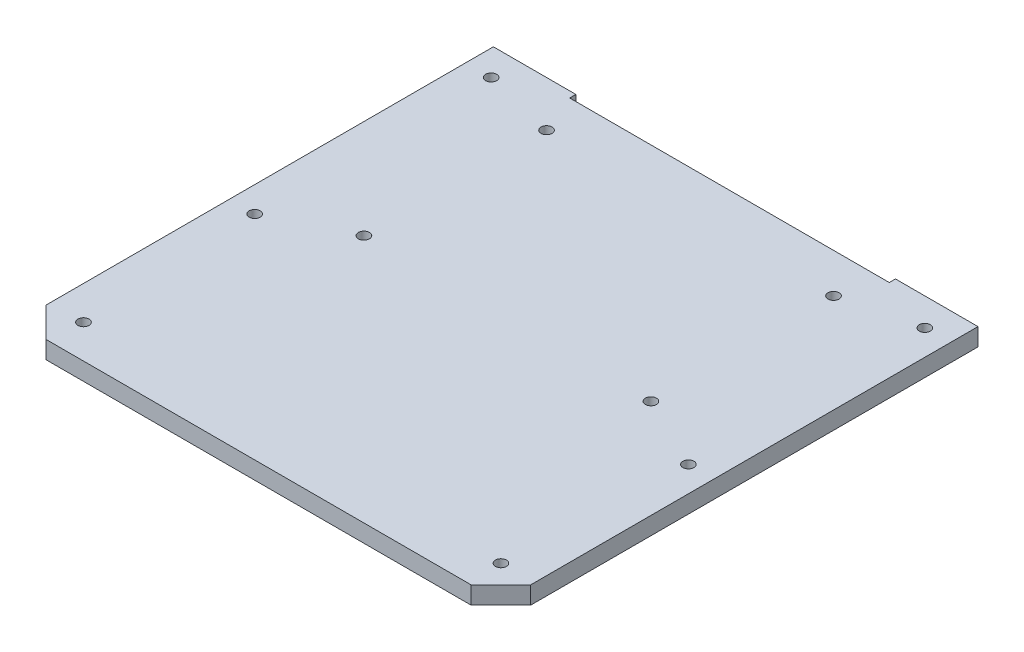
from build123d import *

# Parameters (mm, degrees)
LID_PLATE_DEPTH        = 2.4
DRIP_SKIRT_DEPTH       = 3.01
SKETCH3_W              = 25.3
SKETCH3_H              = 1.9
FRONT_SKIRT_L_DEPTH    = 5.4
SKETCH4_W              = 25.3
SKETCH4_H              = 1.9
FRONT_SKIRT_R_DEPTH    = 5.4
SKETCH5_W              = 63
SKETCH5_H              = 34
GNSS_THIN_WINDOW_DEPTH = 1.7
SKETCH6_R              = 1.7
SCREW_HOLES_DEPTH      = 4.4


with BuildPart() as part:
    # Sketch1 → Lid Plate (new body)
    with BuildSketch(Plane(origin=(0, 10, 0), x_dir=(1, 0, 0), z_dir=(0, 1, 0))):
        Polygon((-65.187005769, -156.3), (65.187005769, -156.3), (74.3, -147.187005769), (74.3, -11.9), (-74.3, -11.9), (-74.3, -147.187005769), align=None)
    extrude(amount=LID_PLATE_DEPTH)

    # Sketch2 → Drip Skirt (add)
    with BuildSketch(Plane(origin=(0, 7, 0), x_dir=(1, 0, 0), z_dir=(0, 1, 0))):
        Polygon((74.3, -11.9), (74.3, -147.187005769), (65.187005769, -156.3), (-65.187005769, -156.3), (-74.3, -147.187005769), (-74.3, -11.9), (-72.7, -11.9), (-72.7, -146.524264069), (-64.524264069, -154.7), (64.524264069, -154.7), (72.7, -146.524264069), (72.7, -11.9), align=None)
    extrude(amount=DRIP_SKIRT_DEPTH)

    # Sketch3 → Front Skirt L (add)
    with BuildSketch(Plane(origin=(0, 7, 0), x_dir=(1, 0, 0), z_dir=(0, 1, 0))):
        with Locations((-61.65, -10.95)):
            Rectangle(SKETCH3_W, SKETCH3_H)
    extrude(amount=FRONT_SKIRT_L_DEPTH)

    # Sketch4 → Front Skirt R (add)
    with BuildSketch(Plane(origin=(0, 7, 0), x_dir=(1, 0, 0), z_dir=(0, 1, 0))):
        with Locations((61.65, -10.95)):
            Rectangle(SKETCH4_W, SKETCH4_H)
    extrude(amount=FRONT_SKIRT_R_DEPTH)

    # Sketch5 → GNSS Thin Window (cut)
    with BuildSketch(Plane(origin=(0, 9.5, 0), x_dir=(1, 0, 0), z_dir=(0, 1, 0))):
        with Locations((-8.5, -123)):
            Rectangle(SKETCH5_W, SKETCH5_H)
    extrude(amount=GNSS_THIN_WINDOW_DEPTH, mode=Mode.SUBTRACT)

    # Sketch6 → Screw Holes (cut)
    with BuildSketch(Plane(origin=(0, 9, 0), x_dir=(1, 0, 0), z_dir=(0, 1, 0))):
        with Locations(Location((-66.5, -18.5, 0), (0, 0, 270))):
            Circle(SKETCH6_R)
        with Locations(Location((66.5, -18.5, 0), (0, 0, 270))):
            Circle(SKETCH6_R)
        with Locations(Location((-66.5, -91, 0), (0, 0, 270))):
            Circle(SKETCH6_R)
        with Locations(Location((66.5, -91, 0), (0, 0, 270))):
            Circle(SKETCH6_R)
        with Locations(Location((-64, -146, 0), (0, 0, 270))):
            Circle(SKETCH6_R)
        with Locations(Location((64, -146, 0), (0, 0, 270))):
            Circle(SKETCH6_R)
        with Locations(Location((-44, -24, 0), (0, 0, 270))):
            Circle(SKETCH6_R)
        with Locations(Location((-44, -80, 0), (0, 0, 270))):
            Circle(SKETCH6_R)
        with Locations(Location((44, -24, 0), (0, 0, 270))):
            Circle(SKETCH6_R)
        with Locations(Location((44, -80, 0), (0, 0, 270))):
            Circle(SKETCH6_R)
    extrude(amount=SCREW_HOLES_DEPTH, mode=Mode.SUBTRACT)


solid = part.part
